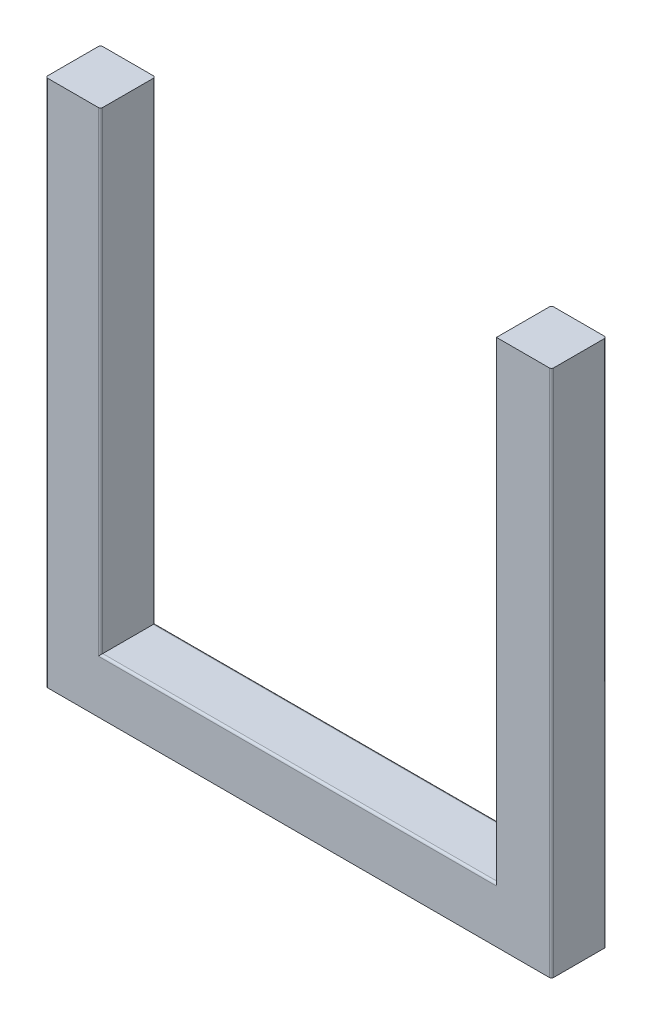
from build123d import *

# Parameters (mm, degrees)
BOSS_EXTRUDE1_DEPTH = 50
FILLET1_R           = 2


with BuildPart() as part:
    # Sketch1 → Boss-Extrude1 (new body)
    with BuildSketch(Plane.XY):
        Polygon((410, 480), (410, 50), (50, 50), (50, 480), (0, 480), (0, 50), (0, 0), (460, 0), (460, 50), (460, 480), align=None)
    extrude(amount=BOSS_EXTRUDE1_DEPTH)

    # Fillet1
    fillet1_edges = [part.edges().sort_by_distance(p)[0] for p in [
        (460, 240, 0),
        (230, 0, 0),
        (0, 240, 0),
        (50, 265, 0),
        (0, 240, 50),
        (460, 240, 50),
        (230, 50, 50),
        (50, 265, 50),
        (230, 50, 0),
        (410, 265, 0),
    ]]
    fillet(fillet1_edges, radius=FILLET1_R)


solid = part.part
